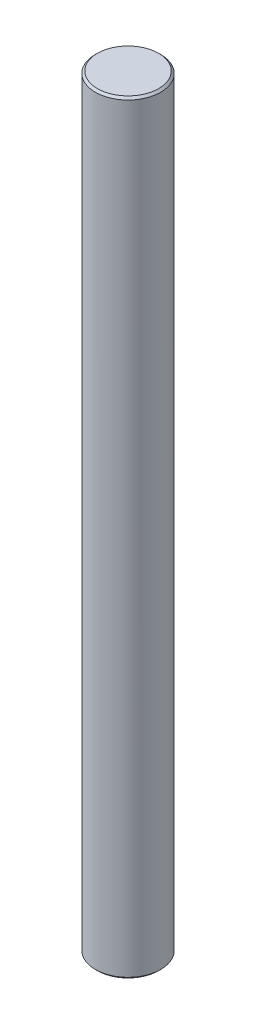
from build123d import *

# Parameters (mm, degrees)
SKETCH1_R           = 3.96875
BOSS_EXTRUDE1_DEPTH = 46.355
CHAMFER1_SIZE       = 0.254


with BuildPart() as part:
    # Sketch1 → Boss-Extrude1 (new, symmetric)
    with BuildSketch(Plane(origin=(0, 0, 0), x_dir=(1, 0, 0), z_dir=(0, 1, 0))):
        with Locations(Location((0, 0, 0), (0, 0, 90))):
            Circle(SKETCH1_R)
    extrude(amount=BOSS_EXTRUDE1_DEPTH, both=True)

    # Chamfer1
    chamfer1_edges = [part.edges().sort_by_distance(p)[0] for p in [
        (0, -46.355, 3.96875),
        (0, 46.355, 3.96875),
    ]]
    chamfer(chamfer1_edges, length=CHAMFER1_SIZE)


solid = part.part
